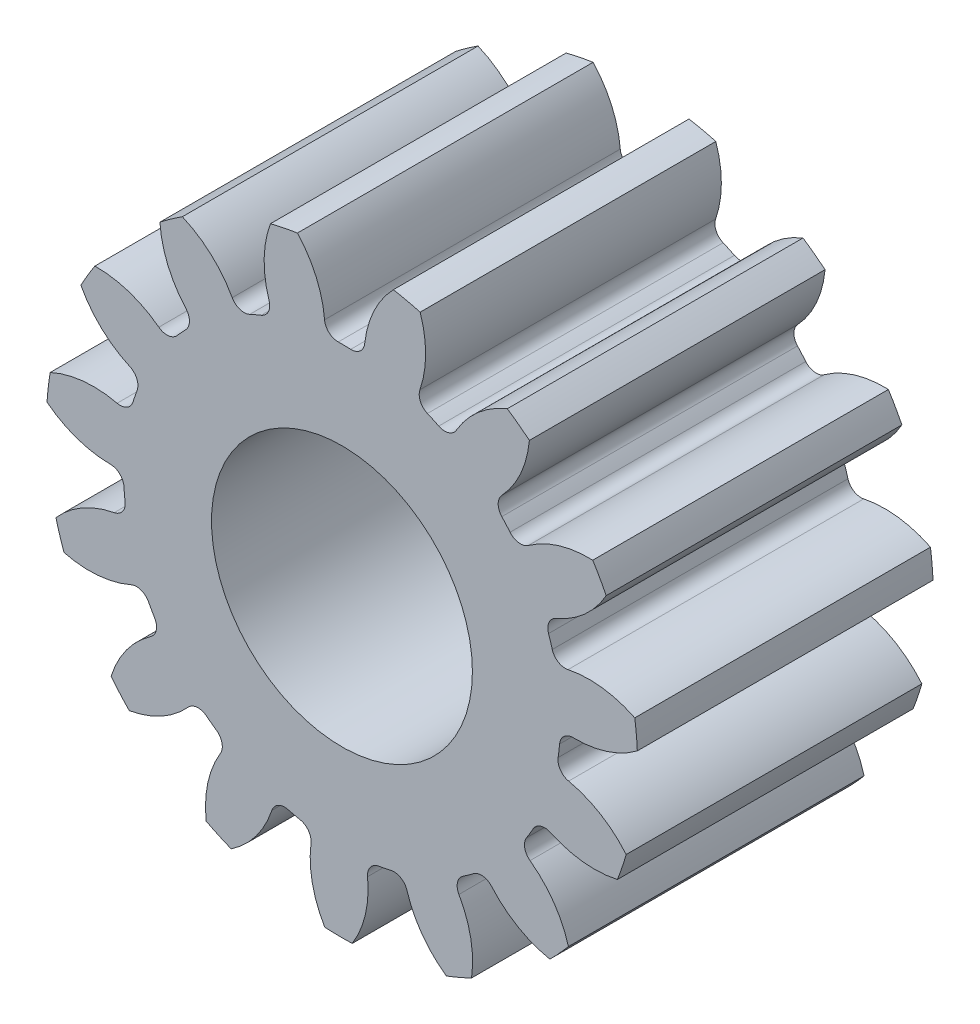
from build123d import *

# Parameters (mm, degrees)
SKETCH3_R               = 21.59
GEARBODY_DEPTH          = 25.4
TOOTHCUT_DEPTH          = 40.716699259
CIRPATTERN1_COUNT       = 15
BOREDIA_R               = 9.525
BORE_DEPTH              = 12700
CUT_EXTRUDE1_DEPTH      = 40.703986775
CUT_EXTRUDE1_DEPTH_BACK = 40.703986775


with BuildPart() as part:
    # Sketch3 → gearBody (new body)
    with BuildSketch(Plane.XY):
        Circle(SKETCH3_R)
    extrude(amount=GEARBODY_DEPTH)

    # Sketch2 → toothCut (cut, through all)
    with BuildSketch(Plane.XY):
        with BuildLine():
            ThreePointArc((15.783846764, -2.304552616), (15.843293638, -1.852249483), (15.889781974, -1.39843136))
            ThreePointArc((15.889781974, -1.39843136), (16.213055843, -0.751556907), (16.890861518, -0.499501321))
            ThreePointArc((16.890861518, -0.499501321), (20.504912911, 0.340315353), (23.283949955, 2.798691365))
            ThreePointArc((23.283949955, 2.798691365), (23.292901215, -2.723187818), (22.010467945, -8.09409042))
            ThreePointArc((22.010467945, -8.09409042), (19.873444675, -5.060974685), (16.550574786, -3.410158156))
            ThreePointArc((16.550574786, -3.410158156), (15.949189176, -3.008551507), (15.783846764, -2.304552616))
        make_face()
    toothcut = extrude(amount=TOOTHCUT_DEPTH, mode=Mode.SUBTRACT)

    # CirPattern1: toothCut ×15 about axis
    cirpattern1_axis = Axis((0, 0, 0), (0, 0, 1))
    for i in range(1, CIRPATTERN1_COUNT):
        add(toothcut.rotate(cirpattern1_axis, i * 360 / CIRPATTERN1_COUNT), mode=Mode.SUBTRACT)

    # boreDia → bore (cut, symmetric)
    with BuildSketch(Plane.XY):
        Circle(BOREDIA_R)
    extrude(amount=BORE_DEPTH, both=True, mode=Mode.SUBTRACT)

    # Sketch4 → Cut-Extrude1 (cut, two sides: drawn at the far end of the back side and taken through both)
    with BuildSketch(Plane(origin=(0, 0, 0), x_dir=(0, 0, -1), z_dir=(1, 0, 0)).offset(-CUT_EXTRUDE1_DEPTH_BACK)):
        Polygon((-3.81, 26.191979423), (-3.81, -31.870423863), (6.096210589, -32.468383172), (8.920928288, 23.481458771), align=None)
    extrude(amount=CUT_EXTRUDE1_DEPTH + CUT_EXTRUDE1_DEPTH_BACK, mode=Mode.SUBTRACT)


solid = part.part
